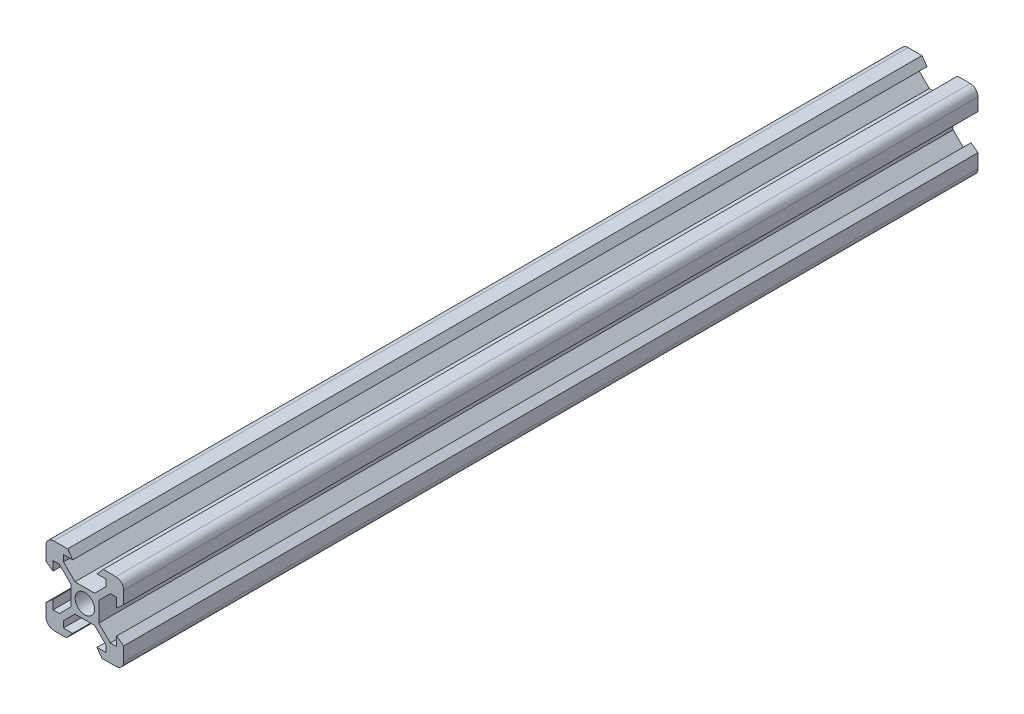
from build123d import *

# Parameters (mm, degrees)
SKETCH1_R           = 2.5
BOSS_EXTRUDE1_DEPTH = 220


with BuildPart() as part:
    # Sketch1 → Boss-Extrude1 (new body)
    with BuildSketch(Plane.XY):
        with BuildLine():
            Line((-4.725542729, -10), (-3.125, -8.2))
            Line((-3.125, -8.2), (-5.5, -8.2))
            Line((-5.5, -8.2), (-5.5, -6.560660172))
            Line((-5.5, -6.560660172), (-2.539339828, -3.6))
            Line((-2.539339828, -3.6), (2.539339828, -3.6))
            Line((2.539339828, -3.6), (5.5, -6.560660172))
            Line((5.5, -6.560660172), (5.5, -8.2))
            Line((5.5, -8.2), (3.125, -8.2))
            Line((3.125, -8.2), (4.434457271, -10))
            Line((4.434457271, -10), (8, -10))
            ThreePointArc((8, -10), (9.414213562, -9.414213562), (10, -8))
            Line((10, -8), (10, -4.434457271))
            Line((10, -4.434457271), (8.2, -3.125))
            Line((8.2, -3.125), (8.2, -5.5))
            Line((8.2, -5.5), (6.560660172, -5.5))
            Line((6.560660172, -5.5), (3.6, -2.539339828))
            Line((3.6, -2.539339828), (3.6, 2.539339828))
            Line((3.6, 2.539339828), (6.560660172, 5.5))
            Line((6.560660172, 5.5), (8.2, 5.5))
            Line((8.2, 5.5), (8.2, 3.125))
            Line((8.2, 3.125), (10, 4.725542729))
            Line((10, 4.725542729), (10, 8))
            ThreePointArc((10, 8), (9.414213562, 9.414213562), (8, 10))
            Line((8, 10), (4.725542729, 10))
            Line((4.725542729, 10), (3.125, 8.2))
            Line((3.125, 8.2), (5.5, 8.2))
            Line((5.5, 8.2), (5.5, 6.560660172))
            Line((5.5, 6.560660172), (2.539339828, 3.6))
            Line((2.539339828, 3.6), (-2.539339828, 3.6))
            Line((-2.539339828, 3.6), (-5.5, 6.560660172))
            Line((-5.5, 6.560660172), (-5.5, 8.2))
            Line((-5.5, 8.2), (-3.125, 8.2))
            Line((-3.125, 8.2), (-4.434457271, 10))
            Line((-4.434457271, 10), (-8, 10))
            ThreePointArc((-8, 10), (-9.414213562, 9.414213562), (-10, 8))
            Line((-10, 8), (-10, 4.434457271))
            Line((-10, 4.434457271), (-8.2, 3.125))
            Line((-8.2, 3.125), (-8.2, 5.5))
            Line((-8.2, 5.5), (-6.560660172, 5.5))
            Line((-6.560660172, 5.5), (-3.6, 2.539339828))
            Line((-3.6, 2.539339828), (-3.6, -2.539339828))
            Line((-3.6, -2.539339828), (-6.560660172, -5.5))
            Line((-6.560660172, -5.5), (-8.2, -5.5))
            Line((-8.2, -5.5), (-8.2, -3.125))
            Line((-8.2, -3.125), (-10, -4.725542729))
            Line((-10, -4.725542729), (-10, -8))
            ThreePointArc((-10, -8), (-9.414213562, -9.414213562), (-8, -10))
            Line((-8, -10), (-4.725542729, -10))
        make_face()
        Circle(SKETCH1_R, mode=Mode.SUBTRACT)
    extrude(amount=BOSS_EXTRUDE1_DEPTH)


solid = part.part
